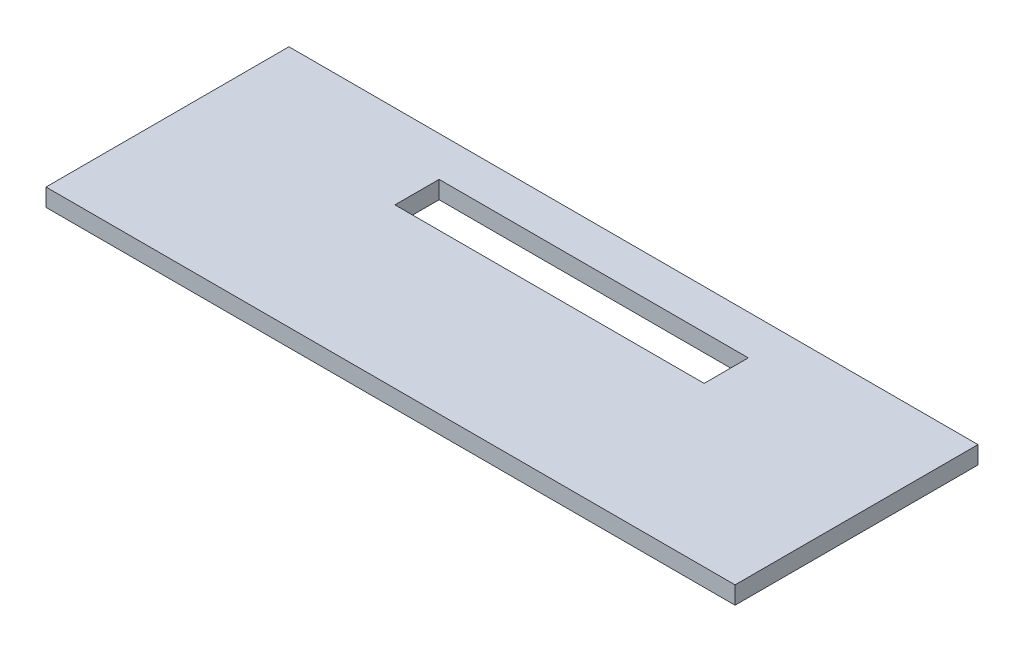
from build123d import *

# Parameters (mm, degrees)
SKETCH1_W           = 156
SKETCH1_H           = 55
SKETCH1_W_2         = 70
SKETCH1_H_2         = 10
BOSS_EXTRUDE1_DEPTH = 4
SKETCH1_2_W         = 156
SKETCH1_2_H         = 55
SKETCH1_2_W_2       = 70
SKETCH1_2_H_2       = 10
BOSS_EXTRUDE2_DEPTH = 4


with BuildPart() as part:
    # Sketch1 → Boss-Extrude1 (new body)
    with BuildSketch(Plane(origin=(0, 0, 0), x_dir=(1, 0, 0), z_dir=(0, 1, 0))):
        Rectangle(SKETCH1_W, SKETCH1_H)
        with Locations((0, 13.5)):
            Rectangle(SKETCH1_W_2, SKETCH1_H_2, mode=Mode.SUBTRACT)
    extrude(amount=BOSS_EXTRUDE1_DEPTH)

    # Sketch1<2> → Boss-Extrude2 (add)
    with BuildSketch(Plane(origin=(0, 0, 0), x_dir=(1, 0, 0), z_dir=(0, 1, 0))):
        Rectangle(SKETCH1_2_W, SKETCH1_2_H)
        with Locations((0, 13.5)):
            Rectangle(SKETCH1_2_W_2, SKETCH1_2_H_2, mode=Mode.SUBTRACT)
    extrude(amount=BOSS_EXTRUDE2_DEPTH)


solid = part.part
